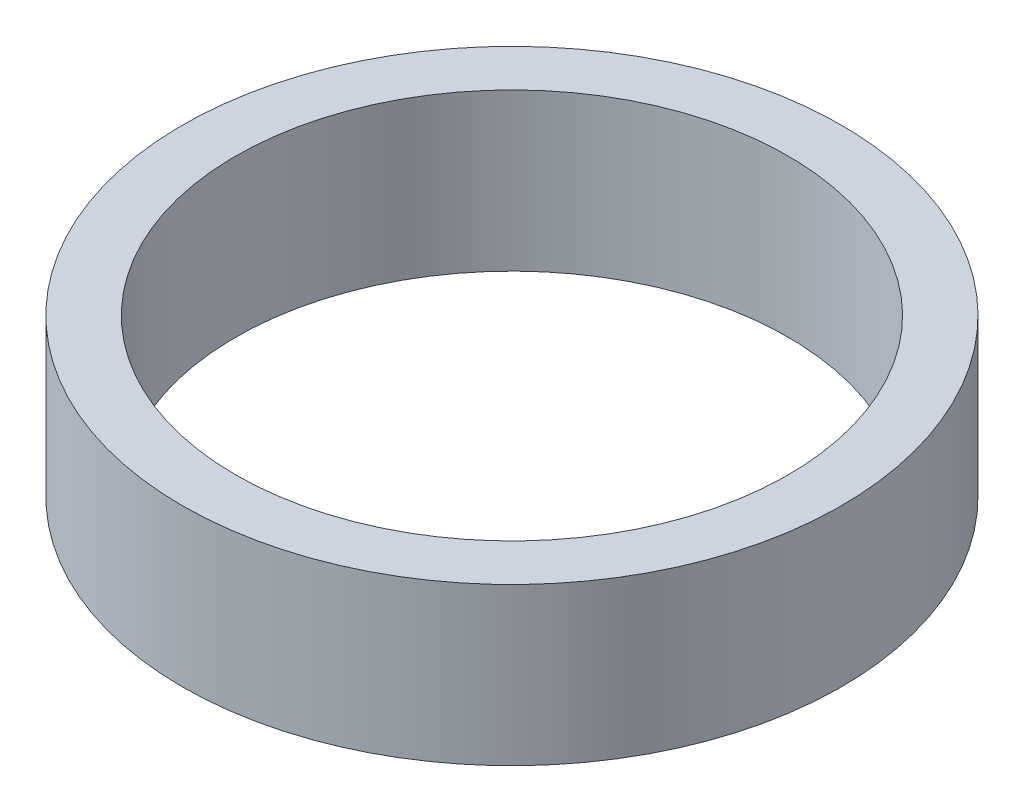
from build123d import *

# Parameters (mm, degrees)
SKETCH_1_R               = 52.5
SKETCH_1_R_2             = 11.15
EXTRUDE_1_DEPTH          = 25
CUT_EXTRUDE_1_DEPTH      = 30
PATTERN_CIRCULAR_1_COUNT = 6
FILLET_1_R               = 5
SKETCH_3_R               = 44
CUT_EXTRUDE_2_DEPTH      = 30


with BuildPart() as part:
    # 草图1 → 凸台-拉伸1 (new body)
    with BuildSketch(Plane(origin=(0, 0, 0), x_dir=(1, 0, 0), z_dir=(0, 1, 0))):
        with Locations(Location((0, 0, 0), (0, 0, 270))):
            Circle(SKETCH_1_R)
        with Locations(Location((0, 0, 0), (0, 0, 270))):
            Circle(SKETCH_1_R_2, mode=Mode.SUBTRACT)
    extrude(amount=EXTRUDE_1_DEPTH)

    # 草图2 → 切除-拉伸1 (cut)
    with BuildSketch(Plane(origin=(0, 25, 0), x_dir=(1, 0, 0), z_dir=(0, 1, 0))):
        with BuildLine():
            ThreePointArc((-21.398006208, 27.062433932), (-29.877876431, 17.25), (-34.135758377, 5))
            Line((-34.135758377, 5), (-21.15, 5))
            Line((-21.15, 5), (-20.550486612, 5))
            ThreePointArc((-20.550486612, 5), (-18.31643729, 10.575), (-14.605370325, 15.297243466))
            Line((-14.605370325, 15.297243466), (-14.905127019, 15.81643729))
            Line((-14.905127019, 15.81643729), (-21.398006208, 27.062433932))
        make_face()
    cut_extrude_1 = extrude(amount=-CUT_EXTRUDE_1_DEPTH, mode=Mode.SUBTRACT)

    # 阵列(圆周)1: 切除-拉伸1 ×6 about axis
    pattern_circular_1_axis = Axis((0, 25, 0), (0, -1, 0))
    for i in range(1, PATTERN_CIRCULAR_1_COUNT):
        add(cut_extrude_1.rotate(pattern_circular_1_axis, i * 360 / PATTERN_CIRCULAR_1_COUNT), mode=Mode.SUBTRACT)

    # 圆角1
    fillet_1_edges = [part.edges().sort_by_distance(p)[0] for p in [
        (-21.398006208, 12.5, -27.062433932),
        (-14.605370325, 12.5, -15.297243466),
        (-20.550486612, 12.5, -5),
        (-34.135758377, 12.5, -5),
        (-34.135758377, 12.5, 5),
        (-20.550486612, 12.5, 5),
        (-14.605370325, 12.5, 15.297243466),
        (-21.398006208, 12.5, 27.062433932),
        (-12.73775217, 12.5, 32.062433932),
        (-5.945116287, 12.5, 20.297243466),
        (5.945116287, 12.5, 20.297243466),
        (12.73775217, 12.5, 32.062433932),
        (21.398006208, 12.5, 27.062433932),
        (14.605370325, 12.5, 15.297243466),
        (20.550486612, 12.5, 5),
        (34.135758377, 12.5, 5),
        (34.135758377, 12.5, -5),
        (20.550486612, 12.5, -5),
        (14.605370325, 12.5, -15.297243466),
        (21.398006208, 12.5, -27.062433932),
        (12.73775217, 12.5, -32.062433932),
        (5.945116287, 12.5, -20.297243466),
        (-5.945116287, 12.5, -20.297243466),
        (-12.73775217, 12.5, -32.062433932),
    ]]
    fillet(fillet_1_edges, radius=FILLET_1_R)

    # 草图3 → 切除-拉伸2 (cut)
    with BuildSketch(Plane(origin=(0, 25, 0), x_dir=(1, 0, 0), z_dir=(0, 1, 0))):
        with Locations(Location((0, 0, 0), (0, 0, 270))):
            Circle(SKETCH_3_R)
        with BuildLine():
            ThreePointArc((9.546562067, -26.535130538), (9.751380834, -31.140900403), (6.100576582, -33.956339104))
            ThreePointArc((6.100576582, -33.956339104), (0, -34.5), (-6.100576582, -33.956339104))
            ThreePointArc((-6.100576582, -33.956339104), (-9.751380834, -31.140900403), (-9.546562067, -26.535130538))
            Line((-9.546562067, -26.535130538), (-7.751082565, -23.425268815))
            ThreePointArc((-7.751082565, -23.425268815), (-5.631733419, -21.440576943), (-2.766853147, -20.968238449))
            ThreePointArc((-2.766853147, -20.968238449), (0, -21.15), (2.766853147, -20.968238449))
            ThreePointArc((2.766853147, -20.968238449), (5.631733419, -21.440576943), (7.751082565, -23.425268815))
            Line((7.751082565, -23.425268815), (9.546562067, -26.535130538))
        make_face(mode=Mode.SUBTRACT)
        with BuildLine():
            ThreePointArc((27.753378173, -5), (31.844501263, -7.125506677), (32.457340575, -11.694915254))
            ThreePointArc((32.457340575, -11.694915254), (29.877876431, -17.25), (26.356763993, -22.26142385))
            ThreePointArc((26.356763993, -22.26142385), (22.093120428, -24.015393726), (18.206816105, -21.535130538))
            Line((18.206816105, -21.535130538), (16.411336602, -18.425268815))
            ThreePointArc((16.411336602, -18.425268815), (15.752217595, -15.59751268), (16.775600596, -12.880284338))
            ThreePointArc((16.775600596, -12.880284338), (18.31643729, -10.575), (19.542453743, -8.087954111))
            ThreePointArc((19.542453743, -8.087954111), (21.383951014, -5.843064263), (24.162419167, -5))
            Line((24.162419167, -5), (27.753378173, -5))
        make_face(mode=Mode.SUBTRACT)
        with BuildLine():
            ThreePointArc((-27.753378173, 5), (-31.844501263, 7.125506677), (-32.457340575, 11.694915254))
            ThreePointArc((-32.457340575, 11.694915254), (-29.877876431, 17.25), (-26.356763993, 22.26142385))
            ThreePointArc((-26.356763993, 22.26142385), (-22.093120428, 24.015393726), (-18.206816105, 21.535130538))
            Line((-18.206816105, 21.535130538), (-16.411336602, 18.425268815))
            ThreePointArc((-16.411336602, 18.425268815), (-15.752217595, 15.59751268), (-16.775600596, 12.880284338))
            ThreePointArc((-16.775600596, 12.880284338), (-18.31643729, 10.575), (-19.542453743, 8.087954111))
            ThreePointArc((-19.542453743, 8.087954111), (-21.383951014, 5.843064263), (-24.162419167, 5))
            Line((-24.162419167, 5), (-27.753378173, 5))
        make_face(mode=Mode.SUBTRACT)
        with BuildLine():
            ThreePointArc((-9.546562067, 26.535130538), (-9.751380834, 31.140900403), (-6.100576582, 33.956339104))
            ThreePointArc((-6.100576582, 33.956339104), (0, 34.5), (6.100576582, 33.956339104))
            ThreePointArc((6.100576582, 33.956339104), (9.751380834, 31.140900403), (9.546562067, 26.535130538))
            Line((9.546562067, 26.535130538), (7.751082565, 23.425268815))
            ThreePointArc((7.751082565, 23.425268815), (5.631733419, 21.440576943), (2.766853147, 20.968238449))
            ThreePointArc((2.766853147, 20.968238449), (0, 21.15), (-2.766853147, 20.968238449))
            ThreePointArc((-2.766853147, 20.968238449), (-5.631733419, 21.440576943), (-7.751082565, 23.425268815))
            Line((-7.751082565, 23.425268815), (-9.546562067, 26.535130538))
        make_face(mode=Mode.SUBTRACT)
        with BuildLine():
            ThreePointArc((18.206816105, 21.535130538), (22.093120428, 24.015393726), (26.356763993, 22.26142385))
            ThreePointArc((26.356763993, 22.26142385), (29.877876431, 17.25), (32.457340575, 11.694915254))
            ThreePointArc((32.457340575, 11.694915254), (31.844501263, 7.125506677), (27.753378173, 5))
            Line((27.753378173, 5), (24.162419167, 5))
            ThreePointArc((24.162419167, 5), (21.383951014, 5.843064263), (19.542453743, 8.087954111))
            ThreePointArc((19.542453743, 8.087954111), (18.31643729, 10.575), (16.775600596, 12.880284338))
            ThreePointArc((16.775600596, 12.880284338), (15.752217595, 15.59751268), (16.411336602, 18.425268815))
            Line((16.411336602, 18.425268815), (18.206816105, 21.535130538))
        make_face(mode=Mode.SUBTRACT)
    extrude(amount=-CUT_EXTRUDE_2_DEPTH, mode=Mode.SUBTRACT)


solid = part.part
